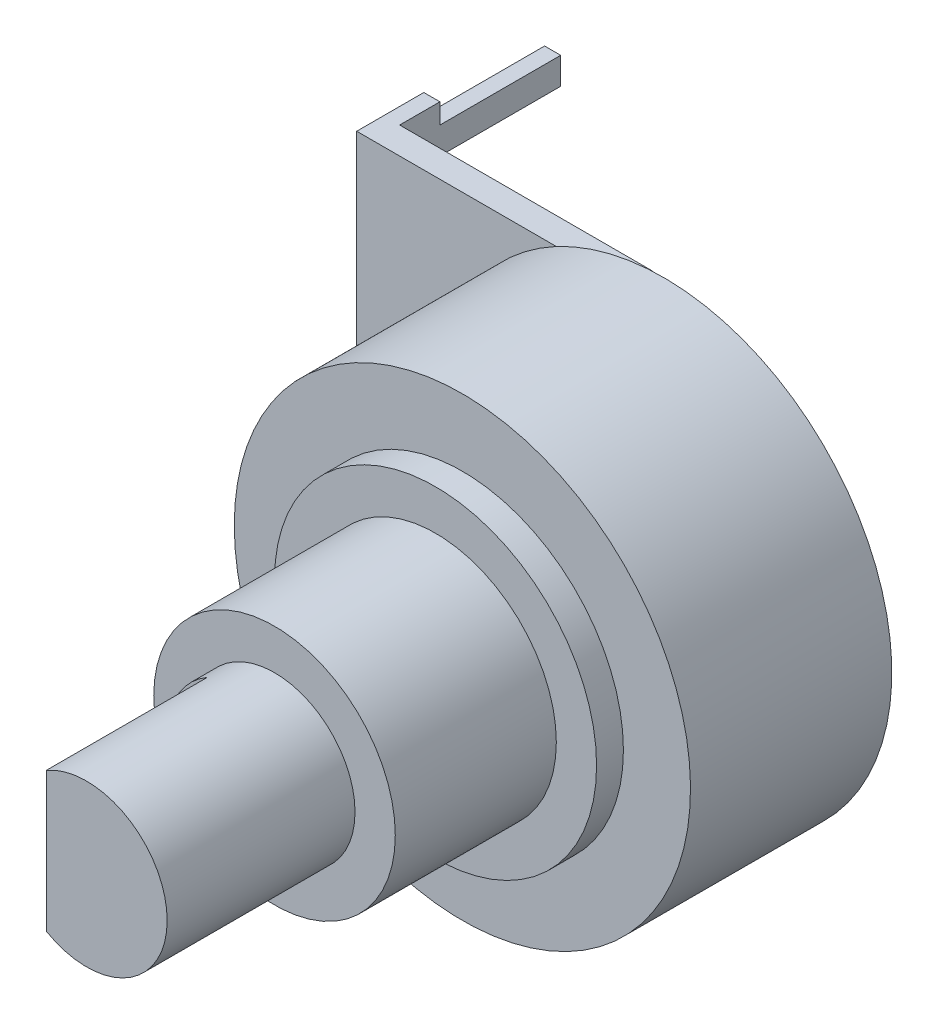
from build123d import *

# Parameters (mm, degrees)
SKETCH_1_R          = 4.5
EXTRUDE_1_DEPTH     = 6
SKETCH_2_R          = 3
EXTRUDE_2_DEPTH     = 7
SKETCH_3_W          = 3.768316072
SKETCH_3_H          = 6.517836593
CUT_EXTRUDE_1_DEPTH = 6
SKETCH_4_R          = 6
EXTRUDE_3_DEPTH     = 1
SKETCH_5_R          = 8.5
EXTRUDE_4_DEPTH     = 7.5
SKETCH_6_W          = 10
SKETCH_6_H          = 15
EXTRUDE_5_DEPTH     = 1
SKETCH_7_W          = 0.6
SKETCH_7_H          = 2.5
EXTRUDE_6_DEPTH     = 6
SKETCH_8_W          = 4.5
SKETCH_8_H          = 0.75
CUT_EXTRUDE_2_DEPTH = 27.645896495


with BuildPart() as part:
    # Эскиз1 → Бобышка-Вытянуть1 (new body)
    with BuildSketch(Plane.XY):
        Circle(SKETCH_1_R)
    extrude(amount=EXTRUDE_1_DEPTH)

    # Эскиз2 → Бобышка-Вытянуть2 (add)
    with BuildSketch(Plane.XY.offset(6)):
        Circle(SKETCH_2_R)
    extrude(amount=EXTRUDE_2_DEPTH)

    # Эскиз3 → Вырез-Вытянуть1 (cut)
    with BuildSketch(Plane.XY.offset(13)):
        with Locations((-3.384158036, 0.355964711)):
            Rectangle(SKETCH_3_W, SKETCH_3_H)
    extrude(amount=-CUT_EXTRUDE_1_DEPTH, mode=Mode.SUBTRACT)

    # Эскиз4 → Бобышка-Вытянуть3 (add)
    with BuildSketch(Plane(origin=(0, 0, 0), x_dir=(-1, 0, 0), z_dir=(0, 0, -1))):
        Circle(SKETCH_4_R)
    extrude(amount=EXTRUDE_3_DEPTH)

    # Эскиз5 → Бобышка-Вытянуть4 (add)
    with BuildSketch(Plane(origin=(0, 0, -1), x_dir=(-1, 0, 0), z_dir=(0, 0, -1))):
        Circle(SKETCH_5_R)
    extrude(amount=EXTRUDE_4_DEPTH)

    # Эскиз6 → Бобышка-Вытянуть5 (add)
    with BuildSketch(Plane(origin=(0, 0, -8.5), x_dir=(-1, 0, 0), z_dir=(0, 0, -1))):
        with Locations((6.437497336, 0)):
            Rectangle(SKETCH_6_W, SKETCH_6_H)
    extrude(amount=EXTRUDE_5_DEPTH)

    # Эскиз7 → Бобышка-Вытянуть6 (add)
    with BuildSketch(Plane(origin=(0, 0, -9.5), x_dir=(-1, 0, 0), z_dir=(0, 0, -1))):
        with Locations((11.137497336, 6.25)):
            Rectangle(SKETCH_7_W, SKETCH_7_H)
        with Locations((11.137497336, 0)):
            Rectangle(SKETCH_7_W, SKETCH_7_H)
        with Locations((11.137497336, -6.25)):
            Rectangle(SKETCH_7_W, SKETCH_7_H)
    extrude(amount=EXTRUDE_6_DEPTH)

    # Эскиз8 → Вырез-Вытянуть2 (cut, through all)
    with BuildSketch(Plane.ZY.offset(11.437497336)):
        with Locations((-13.25, 7.125)):
            Rectangle(SKETCH_8_W, SKETCH_8_H)
        with Locations((-13.25, 5.375)):
            Rectangle(SKETCH_8_W, SKETCH_8_H)
        with Locations((-13.25, 0.875)):
            Rectangle(SKETCH_8_W, SKETCH_8_H)
        with Locations((-13.25, -0.875)):
            Rectangle(SKETCH_8_W, SKETCH_8_H)
        with Locations((-13.25, -5.375)):
            Rectangle(SKETCH_8_W, SKETCH_8_H)
        with Locations((-13.25, -7.125)):
            Rectangle(SKETCH_8_W, SKETCH_8_H)
    extrude(amount=-CUT_EXTRUDE_2_DEPTH, mode=Mode.SUBTRACT)


solid = part.part
